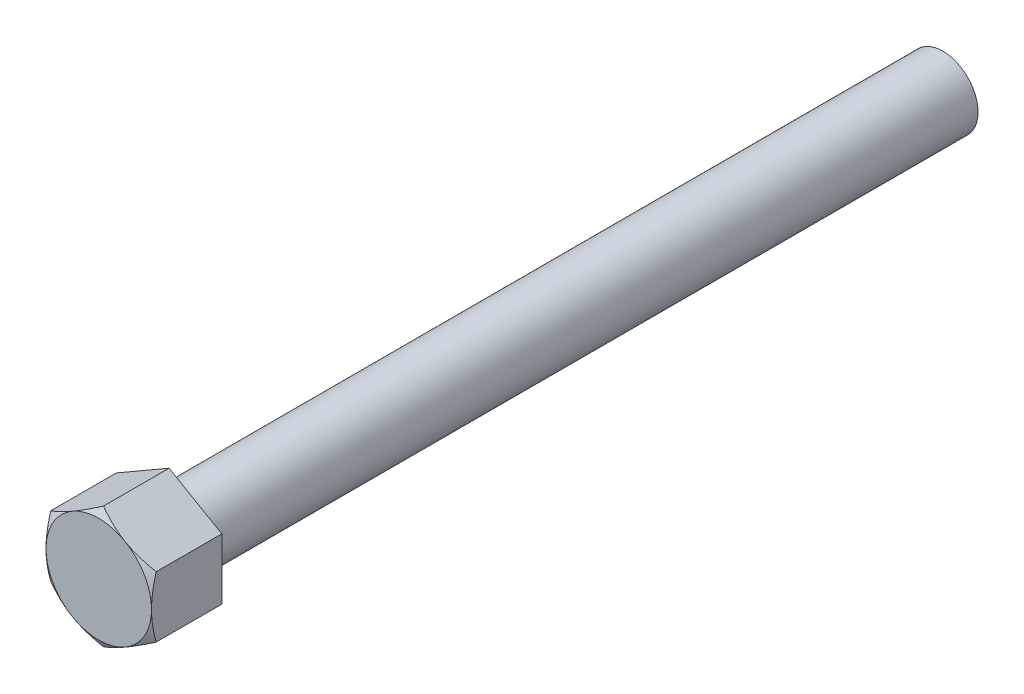
from build123d import *

# Parameters (mm, degrees)
BOSS_EXTRUDE1_DEPTH = 20
SKETCH2_OUTSIDE_W   = 59.32
SKETCH2_OUTSIDE_H   = 63.962
SKETCH2_OUTSIDE_R   = 15
CUT_EXTRUDE1_DEPTH  = 5
CUT_EXTRUDE1_DRAFT  = -60
SKETCH3_R           = 10
BOSS_EXTRUDE2_DEPTH = 220


with BuildPart() as part:
    # Sketch1 → Boss-Extrude1 (new body)
    with BuildSketch(Plane.XY):
        Polygon((0, 17.320508076), (-15, 8.660254038), (-15, -8.660254038), (0, -17.320508076), (15, -8.660254038), (15, 8.660254038), align=None)
    extrude(amount=BOSS_EXTRUDE1_DEPTH)


with BuildPart() as cut_extrude1_tool:
    # Sketch2 outside → Cut-Extrude1 (with draft: the straight prism first)
    with BuildSketch(Plane.XY.offset(20)):
        Rectangle(SKETCH2_OUTSIDE_W, SKETCH2_OUTSIDE_H)
        Circle(SKETCH2_OUTSIDE_R, mode=Mode.SUBTRACT)
    extrude(amount=-CUT_EXTRUDE1_DEPTH)
    # Cut-Extrude1: the draft: its side faces are tilted about the plane it starts from
    cut_extrude1_sides = [cut_extrude1_tool.faces().sort_by_distance(p)[0] for p in [
        (0, -31.981, 17.5),
        (29.66, 0, 17.5),
        (0, 31.981, 17.5),
        (-29.66, 0, 17.5),
        (-15, 0, 17.5),
    ]]
    draft(cut_extrude1_sides, Plane.XY.offset(20), CUT_EXTRUDE1_DRAFT)


with BuildPart() as part_1:
    add(part.part)

    # Cut-Extrude1: cut by cut_extrude1_tool
    add(cut_extrude1_tool.part, mode=Mode.SUBTRACT)

    # Sketch3 → Boss-Extrude2 (add)
    with BuildSketch(Plane(origin=(0, 0, 0), x_dir=(-1, 0, 0), z_dir=(0, 0, -1))):
        Circle(SKETCH3_R)
    extrude(amount=BOSS_EXTRUDE2_DEPTH)


solid = part_1.part
